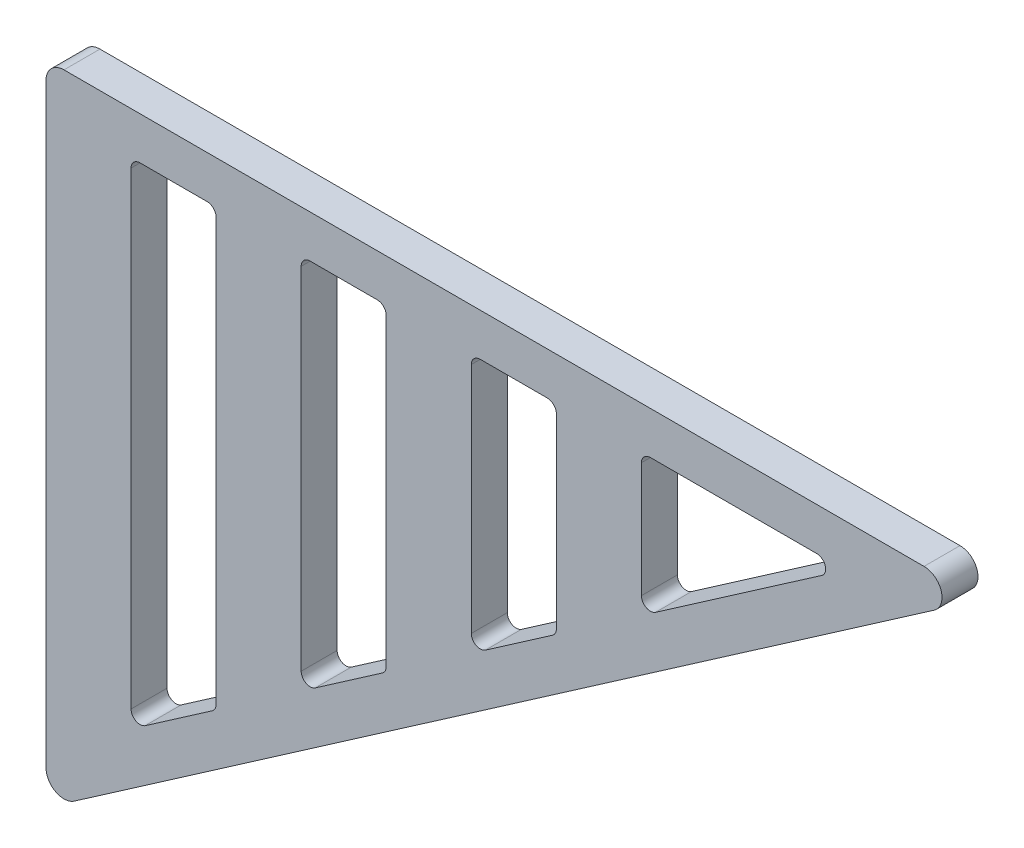
from build123d import *

# Parameters (mm, degrees)
BOSS_EXTRUDE2_DEPTH = 50.8


with BuildPart() as part:
    # Sketch1 → Boss-Extrude2 (new body)
    with BuildSketch(Plane.XY):
        with BuildLine():
            Line((0, 48.477635603), (0, 889))
            ThreePointArc((0, 889), (7.439487758, 906.960512242), (25.4, 914.4))
            Line((25.4, 914.4), (1239.487859684, 914.4))
            ThreePointArc((1239.487859684, 914.4), (1263.732503571, 896.573456464), (1253.945793147, 868.116318332))
            Line((1253.945793147, 868.116318332), (39.857933462, 27.593953935))
            ThreePointArc((39.857933462, 27.593953935), (13.611690324, 25.978841081), (0, 48.477635603))
        make_face()
        with BuildLine():
            Line((120.072727273, 180.3859565), (120.072727273, 841.663636364))
            ThreePointArc((120.072727273, 841.663636364), (123.792471152, 850.643892485), (132.772727273, 854.363636364))
            Line((132.772727273, 854.363636364), (227.445454545, 854.363636364))
            ThreePointArc((227.445454545, 854.363636364), (236.425710667, 850.643892485), (240.145454545, 841.663636364))
            Line((240.145454545, 841.663636364), (240.145454545, 245.928613843))
            ThreePointArc((240.145454545, 245.928613843), (238.694851807, 240.034459004), (234.674421277, 235.486773009))
            Line((234.674421277, 235.486773009), (140.001694004, 169.944115666))
            ThreePointArc((140.001694004, 169.944115666), (126.878572434, 169.136559239), (120.072727273, 180.3859565))
        make_face(mode=Mode.SUBTRACT)
        with BuildLine():
            Line((360.218181818, 346.640501955), (360.218181818, 841.663636364))
            ThreePointArc((360.218181818, 841.663636364), (363.937925697, 850.643892485), (372.918181818, 854.363636364))
            Line((372.918181818, 854.363636364), (467.590909091, 854.363636364))
            ThreePointArc((467.590909091, 854.363636364), (476.571165212, 850.643892485), (480.290909091, 841.663636364))
            Line((480.290909091, 841.663636364), (480.290909091, 412.183159297))
            ThreePointArc((480.290909091, 412.183159297), (478.840306352, 406.289004459), (474.819875822, 401.741318463))
            Line((474.819875822, 401.741318463), (380.147148549, 336.198661121))
            ThreePointArc((380.147148549, 336.198661121), (367.02402698, 335.391104693), (360.218181818, 346.640501955))
        make_face(mode=Mode.SUBTRACT)
        with BuildLine():
            Line((600.363636364, 512.895047409), (600.363636364, 841.663636364))
            ThreePointArc((600.363636364, 841.663636364), (604.083380243, 850.643892485), (613.063636364, 854.363636364))
            Line((613.063636364, 854.363636364), (707.736363636, 854.363636364))
            ThreePointArc((707.736363636, 854.363636364), (716.716619757, 850.643892485), (720.436363636, 841.663636364))
            Line((720.436363636, 841.663636364), (720.436363636, 578.437704752))
            ThreePointArc((720.436363636, 578.437704752), (718.985760898, 572.543549914), (714.965330368, 567.995863918))
            Line((714.965330368, 567.995863918), (620.292603095, 502.453206575))
            ThreePointArc((620.292603095, 502.453206575), (607.169481525, 501.645650148), (600.363636364, 512.895047409))
        make_face(mode=Mode.SUBTRACT)
        with BuildLine():
            Line((840.509090909, 679.149592864), (840.509090909, 841.663636364))
            ThreePointArc((840.509090909, 841.663636364), (844.228834788, 850.643892485), (853.209090909, 854.363636364))
            Line((853.209090909, 854.363636364), (1087.951598187, 854.363636364))
            ThreePointArc((1087.951598187, 854.363636364), (1100.07392013, 845.450364596), (1095.180564918, 831.22179553))
            Line((1095.180564918, 831.22179553), (860.43805764, 668.70775203))
            ThreePointArc((860.43805764, 668.70775203), (847.314936071, 667.900195602), (840.509090909, 679.149592864))
        make_face(mode=Mode.SUBTRACT)
    extrude(amount=BOSS_EXTRUDE2_DEPTH)


solid = part.part
